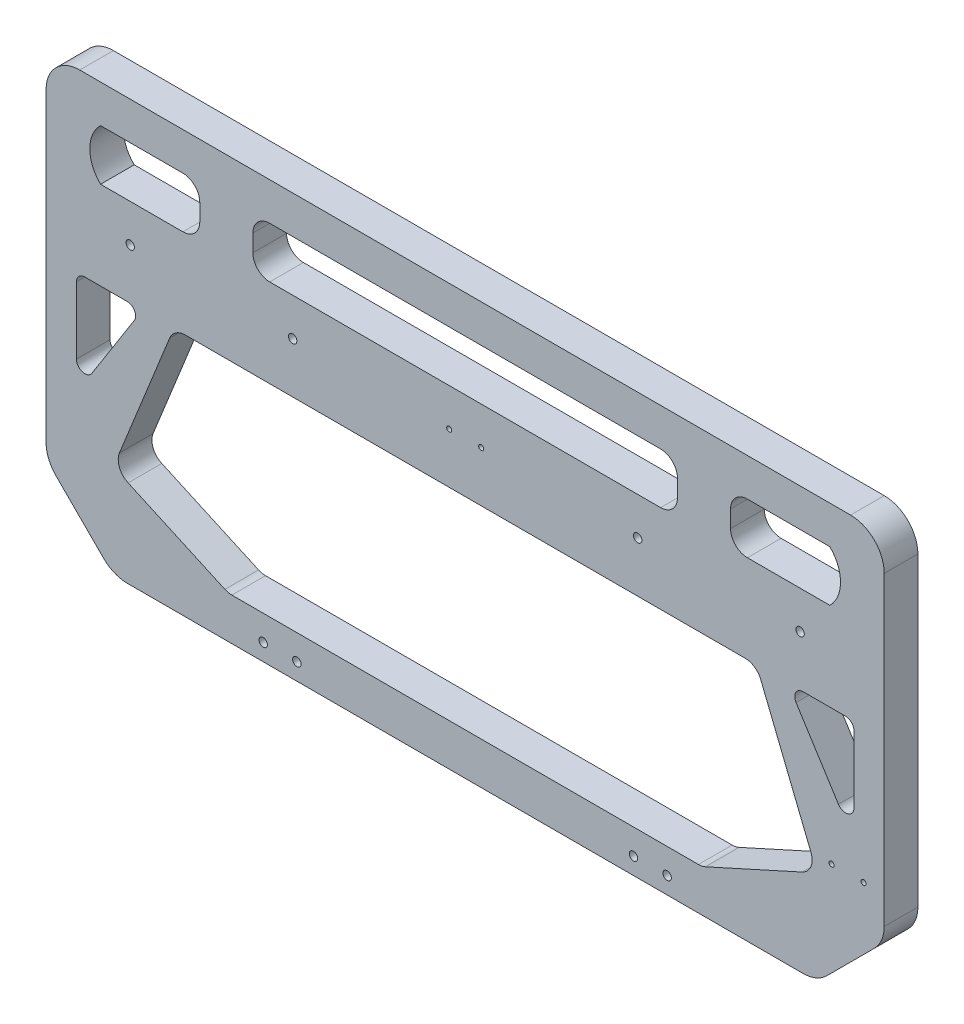
from build123d import *

# Parameters (mm, degrees)
SKETCH1_R           = 2.5
SKETCH1_R_2         = 1.5
BOSS_EXTRUDE1_DEPTH = 20
SKETCH3_R           = 2.5
CUT_EXTRUDE1_DEPTH  = 20
SKETCH4_R           = 1.5
CUT_EXTRUDE2_DEPTH  = 20


with BuildPart() as part:
    # Sketch1 → Boss-Extrude1 (new body)
    with BuildSketch(Plane.XY):
        with BuildLine():
            Line((-200.715728753, -125), (200.715728753, -125))
            ThreePointArc((200.715728753, -125), (208.3693974, -123.47759065), (214.857864376, -119.142135624))
            Line((214.857864376, -119.142135624), (243.142135624, -90.857864376))
            ThreePointArc((243.142135624, -90.857864376), (247.47759065, -84.3693974), (249, -76.715728753))
            Line((249, -76.715728753), (249, 105))
            ThreePointArc((249, 105), (243.142135624, 119.142135624), (229, 125))
            Line((229, 125), (-229, 125))
            ThreePointArc((-229, 125), (-243.142135624, 119.142135624), (-249, 105))
            Line((-249, 105), (-249, -76.715728753))
            ThreePointArc((-249, -76.715728753), (-247.47759065, -84.3693974), (-243.142135624, -90.857864376))
            Line((-243.142135624, -90.857864376), (-214.857864376, -119.142135624))
            ThreePointArc((-214.857864376, -119.142135624), (-208.3693974, -123.47759065), (-200.715728753, -125))
        make_face()
        with Locations((-199, 50)):
            Circle(SKETCH1_R, mode=Mode.SUBTRACT)
        with Locations((-102.5, 50)):
            Circle(SKETCH1_R, mode=Mode.SUBTRACT)
        with Locations(Location((102.5, 50, 0), (0, 0, 180))):
            Circle(SKETCH1_R, mode=Mode.SUBTRACT)
        with Locations(Location((199, 50, 0), (0, 0, 180))):
            Circle(SKETCH1_R, mode=Mode.SUBTRACT)
        with Locations((-9.5, 50)):
            Circle(SKETCH1_R_2, mode=Mode.SUBTRACT)
        with Locations(Location((9.5, 50, 0), (0, 0, 180))):
            Circle(SKETCH1_R_2, mode=Mode.SUBTRACT)
        with BuildLine():
            Line((116.131800265, 102.563522474), (-116.131800265, 102.563522474))
            ThreePointArc((-116.131800265, 102.563522474), (-123.202868077, 99.634590285), (-126.131800265, 92.563522474))
            Line((-126.131800265, 92.563522474), (-126.131800265, 82.389498448))
            ThreePointArc((-126.131800265, 82.389498448), (-123.202868077, 75.318430636), (-116.131800265, 72.389498448))
            Line((-116.131800265, 72.389498448), (116.131800265, 72.389498448))
            ThreePointArc((116.131800265, 72.389498448), (123.202868077, 75.318430636), (126.131800265, 82.389498448))
            Line((126.131800265, 82.389498448), (126.131800265, 92.563522474))
            ThreePointArc((126.131800265, 92.563522474), (123.202868077, 99.634590285), (116.131800265, 102.563522474))
        make_face(mode=Mode.SUBTRACT)
        with BuildLine():
            Line((-216.653872342, 102.563522474), (-167.698471554, 102.563522474))
            ThreePointArc((-167.698471554, 102.563522474), (-160.627403742, 99.634590285), (-157.698471554, 92.563522474))
            Line((-157.698471554, 92.563522474), (-157.698471554, 82.389498448))
            ThreePointArc((-157.698471554, 82.389498448), (-160.627403742, 75.318430636), (-167.698471554, 72.389498448))
            Line((-167.698471554, 72.389498448), (-216.653872342, 72.389498448))
            ThreePointArc((-216.653872342, 72.389498448), (-223.033485264, 87.476510461), (-216.653872342, 102.563522474))
        make_face(mode=Mode.SUBTRACT)
        with BuildLine():
            Line((166.318803771, 20), (-166.318803771, 20))
            ThreePointArc((-166.318803771, 20), (-171.913744739, 18.288343355), (-175.593362129, 13.739327113))
            Line((-175.593362129, 13.739327113), (-205.413984615, -60.224007784))
            ThreePointArc((-205.413984615, -60.224007784), (-205.421516172, -67.683927162), (-200.263522564, -73.073320059))
            Line((-200.263522564, -73.073320059), (-142.749435826, -99.109985162))
            ThreePointArc((-142.749435826, -99.109985162), (-140.734859414, -99.774964236), (-138.625339518, -100))
            Line((-138.625339518, -100), (138.625339518, -100))
            ThreePointArc((138.625339518, -100), (140.734859414, -99.774964236), (142.749435826, -99.109985162))
            Line((142.749435826, -99.109985162), (200.263522564, -73.073320059))
            ThreePointArc((200.263522564, -73.073320059), (205.421516172, -67.683927162), (205.413984615, -60.224007784))
            Line((205.413984615, -60.224007784), (175.593362129, 13.739327113))
            ThreePointArc((175.593362129, 13.739327113), (171.913744739, 18.288343355), (166.318803771, 20))
        make_face(mode=Mode.SUBTRACT)
        with BuildLine():
            Line((-231, 15), (-231, -24.756893222))
            ThreePointArc((-231, -24.756893222), (-227.392475088, -29.55908159), (-221.775594749, -27.431664291))
            Line((-221.775594749, -27.431664291), (-196.602681295, 12.325228931))
            ThreePointArc((-196.602681295, 12.325228931), (-196.446798009, 17.411031382), (-200.827086546, 20))
            Line((-200.827086546, 20), (-226, 20))
            ThreePointArc((-226, 20), (-229.535533906, 18.535533906), (-231, 15))
        make_face(mode=Mode.SUBTRACT)
        with BuildLine():
            Line((221.775594749, -27.431664291), (196.602681295, 12.325228931))
            ThreePointArc((196.602681295, 12.325228931), (196.446798009, 17.411031382), (200.827086546, 20))
            Line((200.827086546, 20), (226, 20))
            ThreePointArc((226, 20), (229.535533906, 18.535533906), (231, 15))
            Line((231, 15), (231, -24.756893222))
            ThreePointArc((231, -24.756893222), (227.392475088, -29.55908159), (221.775594749, -27.431664291))
        make_face(mode=Mode.SUBTRACT)
        with BuildLine():
            Line((157.698471554, 92.563522474), (157.698471554, 82.389498448))
            ThreePointArc((157.698471554, 82.389498448), (160.627403742, 75.318430636), (167.698471554, 72.389498448))
            Line((167.698471554, 72.389498448), (216.653872342, 72.389498448))
            ThreePointArc((216.653872342, 72.389498448), (223.033485264, 87.476510461), (216.653872342, 102.563522474))
            Line((216.653872342, 102.563522474), (167.698471554, 102.563522474))
            ThreePointArc((167.698471554, 102.563522474), (160.627403742, 99.634590285), (157.698471554, 92.563522474))
        make_face(mode=Mode.SUBTRACT)
    extrude(amount=BOSS_EXTRUDE1_DEPTH)

    # Sketch3 → Cut-Extrude1 (cut)
    with BuildSketch(Plane.XY.offset(20)):
        with Locations((-100, -115)):
            Circle(SKETCH3_R)
        with Locations((-120, -115)):
            Circle(SKETCH3_R)
        with Locations(Location((100, -115, 0), (0, 0, 180))):
            Circle(SKETCH3_R)
        with Locations(Location((120, -115, 0), (0, 0, 180))):
            Circle(SKETCH3_R)
    extrude(amount=-CUT_EXTRUDE1_DEPTH, mode=Mode.SUBTRACT)

    # Sketch4 → Cut-Extrude2 (cut)
    with BuildSketch(Plane.XY.offset(20)):
        with Locations((217.706992308, -60.224007784)):
            Circle(SKETCH4_R)
        with Locations((236.706992308, -60.224007784)):
            Circle(SKETCH4_R)
    extrude(amount=-CUT_EXTRUDE2_DEPTH, mode=Mode.SUBTRACT)


solid = part.part
